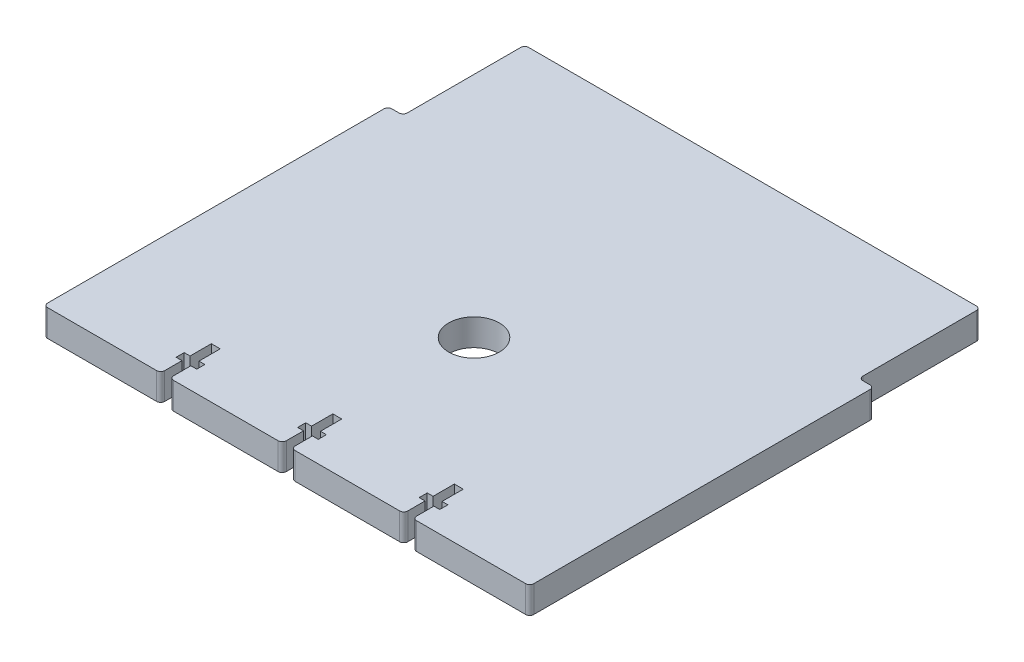
from build123d import *

# Parameters (mm, degrees)
BOSS_EXTRUDE1_DEPTH          = 8.382
CUT_EXTRUDE2_DEPTH           = 208.840544241
F_5_8_0_625_DIAMETER_HOLE1_D = 15.875
FILLET1_R                    = 1.27


with BuildPart() as part:
    # Sketch1 → Boss-Extrude1 (new body)
    with BuildSketch(Plane(origin=(0, 0, 0), x_dir=(1, 0, 0), z_dir=(0, 1, 0))):
        Polygon((0, 0), (142.875, 0), (147.6375, 0), (147.6375, 107.95), (142.875, 107.95), (142.875, 146.05), (0, 146.05), (0, 107.95), (-4.7625, 107.95), (-4.7625, 0), align=None)
    extrude(amount=BOSS_EXTRUDE1_DEPTH)

    # Sketch10 → Cut-Extrude2 (cut, through all)
    with BuildSketch(Plane(origin=(0, 8.382, 0), x_dir=(1, 0, 0), z_dir=(0, 1, 0))):
        Polygon((70.0405, 9.2075), (68.199, 9.2075), (68.199, 6.6675), (70.0405, 6.6675), (70.0405, 0), (72.8345, 0), (72.8345, 6.6675), (74.676, 6.6675), (74.676, 9.2075), (72.8345, 9.2075), (72.8345, 15.875), (70.0405, 15.875), align=None)
        Polygon((108.1405, 15.875), (110.9345, 15.875), (110.9345, 9.2075), (112.776, 9.2075), (112.776, 6.6675), (110.9345, 6.6675), (110.9345, 0), (108.1405, 0), (108.1405, 6.6675), (106.299, 6.6675), (106.299, 9.2075), (108.1405, 9.2075), align=None)
        Polygon((34.7345, 15.875), (34.7345, 9.2075), (36.576, 9.2075), (36.576, 6.6675), (34.7345, 6.6675), (34.7345, 0), (31.9405, 0), (31.9405, 6.6675), (30.099, 6.6675), (30.099, 9.2075), (31.9405, 9.2075), (31.9405, 15.875), align=None)
    extrude(amount=-CUT_EXTRUDE2_DEPTH, mode=Mode.SUBTRACT)

    # 5/8 (0.625) Diameter Hole1 (through all)
    with Locations(Plane(origin=(0, 0, 0), x_dir=(-1, 0, 0), z_dir=(0, -1, 0))):
        with Locations((-71.4375, 58.7375)):
            Hole(F_5_8_0_625_DIAMETER_HOLE1_D / 2)

    # Fillet1
    fillet1_edges = [part.edges().sort_by_distance(p)[0] for p in [
        (34.7345, 4.191, 0),
        (31.9405, 4.191, 0),
        (-4.7625, 4.191, 0),
        (-4.7625, 4.191, -107.95),
        (0, 4.191, -107.95),
        (0, 4.191, -146.05),
        (142.875, 4.191, -146.05),
        (142.875, 4.191, -107.95),
        (147.6375, 4.191, -107.95),
        (147.6375, 4.191, 0),
        (72.8345, 4.191, 0),
        (70.0405, 4.191, 0),
        (110.9345, 4.191, 0),
        (108.1405, 4.191, 0),
    ]]
    fillet(fillet1_edges, radius=FILLET1_R)


solid = part.part
